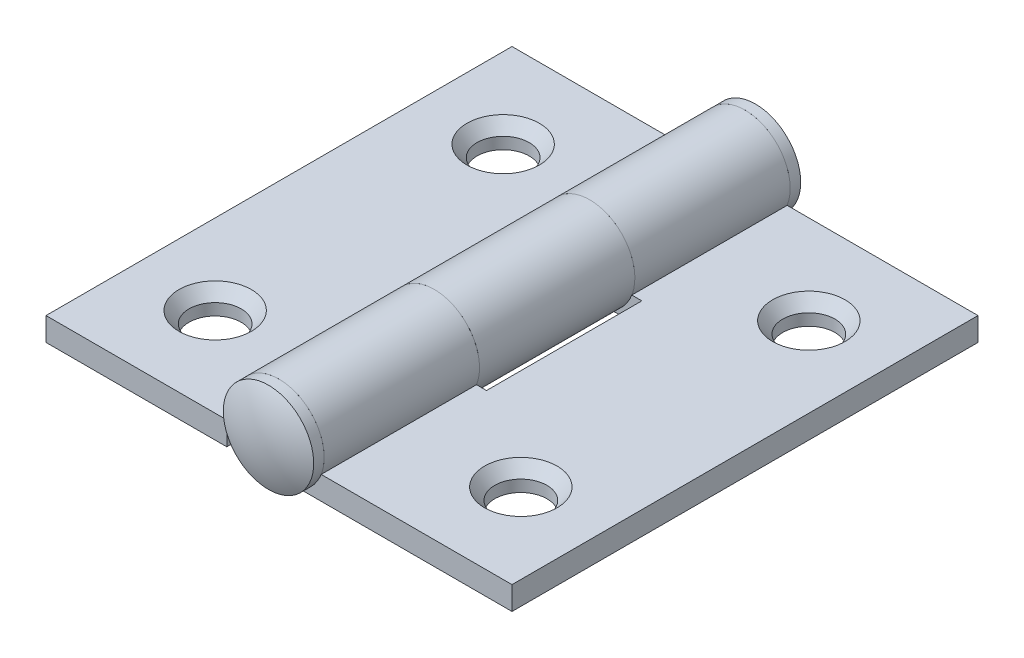
from build123d import *
from OCP.BRepFilletAPI import BRepFilletAPI_MakeChamfer

# Parameters (mm, degrees)
SKETCH1_R                 = 1.190625
EXTRUDE1_DEPTH            = 12.7
SKETCH1_W                 = 9.8552
SKETCH1_H                 = 1.27
EXTRUDE1_2_DEPTH          = 12.7
SKETCH20_R                = 1.4224
EXTRUDE24_DEPTH           = 20.082626232
CHAMFER2_SIZE             = 0.635
CHAMFER2_SIZE2            = 0.551997079
CHAMFER2_OF_MIRROR2_SIZE  = 0.635
CHAMFER2_OF_MIRROR2_SIZE2 = 0.551997079
EXTRUDE4_DEPTH            = 19.94700397
EXTRUDE4_DEPTH_BACK       = 19.94700397
SKETCH8_W                 = 5.6896
SKETCH8_H                 = 8.466666666
SKETCH9_R                 = 1.190625
EXTRUDE5_DEPTH            = 8.466666667


with BuildPart() as part:
    # Sketch1 → Extrude1 (new, symmetric)
    with BuildSketch(Plane.XY):
        with BuildLine():
            Line((12.7, -2.157017049), (1.190625, -2.157017049))
            ThreePointArc((1.190625, -2.157017049), (-1.856577095, 1.619701185), (2.298588957, -0.887017049))
            Line((2.298588957, -0.887017049), (12.7, -0.887017049))
            Line((12.7, -0.887017049), (12.7, -2.157017049))
        make_face()
        Circle(SKETCH1_R, mode=Mode.SUBTRACT)
    extrude(amount=EXTRUDE1_DEPTH, both=True)


with BuildPart() as body_2:
    # Sketch1 → Extrude1 2 (new, symmetric)
    with BuildSketch(Plane.XY):
        with Locations((-7.7724, -1.522017049)):
            Rectangle(SKETCH1_W, SKETCH1_H)
    extrude(amount=EXTRUDE1_2_DEPTH, both=True)

    # Sketch20 → Extrude24 (cut, through all)
    with BuildSketch(Plane(origin=(0, -0.887017049, 0), x_dir=(1, 0, 0), z_dir=(0, 1, 0))):
        with Locations(Location((-8.3312, 7.8486, 0), (0, 0, 270))):
            Circle(SKETCH20_R)
        with Locations(Location((-8.3312, -7.8486, 0), (0, 0, 270))):
            Circle(SKETCH20_R)
    extrude24 = extrude(amount=-EXTRUDE24_DEPTH, mode=Mode.SUBTRACT)

    # Chamfer2: one chamfer whose edges measure the first distance from different faces: ONE call of the kernel's chamfer builder (chamfer() names one face for all edges)
    chamfer2_edges_1 = [body_2.edges().sort_by_distance(p)[0] for p in [
        (-8.3312, -0.887017049, -9.271),
    ]]
    chamfer2_side_1 = [body_2.faces().sort_by_distance(p)[0] for p in [
        (-8.3312, -1.522017049, -9.271),
    ]]
    chamfer2_edges_2 = [body_2.edges().sort_by_distance(p)[0] for p in [
        (-8.3312, -0.887017049, 6.4262),
    ]]
    chamfer2_side_2 = [body_2.faces().sort_by_distance(p)[0] for p in [
        (-8.3312, -1.522017049, 6.4262),
    ]]
    chamfer2 = BRepFilletAPI_MakeChamfer(body_2.part.solid().wrapped)
    for e in chamfer2_edges_1:
        chamfer2.Add(CHAMFER2_SIZE, CHAMFER2_SIZE2, e.wrapped, chamfer2_side_1[0].wrapped)  # the first distance lies on this face
    for e in chamfer2_edges_2:
        chamfer2.Add(CHAMFER2_SIZE, CHAMFER2_SIZE2, e.wrapped, chamfer2_side_2[0].wrapped)  # the first distance lies on this face
    add(Compound.cast(chamfer2.Shape()), mode=Mode.REPLACE)

    # Sketch9 → Extrude5 (add)
    with BuildSketch(Plane.XY.offset(-4.233333333)):
        with BuildLine():
            Line((-2.298588957, -0.887017049), (-2.8448, -0.887017049))
            Line((-2.8448, -0.887017049), (-2.8448, -2.157017049))
            Line((-2.8448, -2.157017049), (-1.190625, -2.157017049))
            ThreePointArc((-1.190625, -2.157017049), (1.856577095, 1.619701185), (-2.298588957, -0.887017049))
        make_face()
        with Locations(Location((0, 0, 0), (0, 0, 180))):
            Circle(SKETCH9_R, mode=Mode.SUBTRACT)
    extrude(amount=EXTRUDE5_DEPTH)


with BuildPart() as body_3:
    # Sketch6 → Revolve1 (revolve)
    with BuildSketch(Plane(origin=(0, 0, 0), x_dir=(1, 0, 0), z_dir=(0, 1, 0))):
        with BuildLine():
            Line((-2.4638, -12.7), (-2.4638, -13.2715))
            ThreePointArc((-2.4638, -13.2715), (-1.264606924, -13.698253184), (0, -13.843))
            Line((0, -13.843), (0, 13.843))
            ThreePointArc((0, 13.843), (-1.264606924, 13.698253184), (-2.4638, 13.2715))
            Line((-2.4638, 13.2715), (-2.4638, 12.7))
            Line((-2.4638, 12.7), (-1.190625, 12.7))
            Line((-1.190625, 12.7), (-1.190625, -12.7))
            Line((-1.190625, -12.7), (-2.4638, -12.7))
        make_face()
    revolve(axis=Axis((0, 0, -13.843), (0, 0, 1)))


with BuildPart() as part_1:
    add(part.part)

    # Mirror2: Extrude24 across plane
    add(extrude24.mirror(Plane(origin=(0, 0, 0), x_dir=(0, 0, 1), z_dir=(1, 0, 0))), mode=Mode.SUBTRACT)

    # Chamfer2 of Mirror2: one chamfer whose edges measure the first distance from different faces: ONE call of the kernel's chamfer builder (chamfer() names one face for all edges)
    chamfer2_of_mirror2_edges_1 = [part_1.edges().sort_by_distance(p)[0] for p in [
        (8.3312, -0.887017049, -9.271),
    ]]
    chamfer2_of_mirror2_side_1 = [part_1.faces().sort_by_distance(p)[0] for p in [
        (8.3312, -1.522017049, -9.271),
    ]]
    chamfer2_of_mirror2_edges_2 = [part_1.edges().sort_by_distance(p)[0] for p in [
        (8.3312, -0.887017049, 6.4262),
    ]]
    chamfer2_of_mirror2_side_2 = [part_1.faces().sort_by_distance(p)[0] for p in [
        (8.3312, -1.522017049, 6.4262),
    ]]
    chamfer2_of_mirror2 = BRepFilletAPI_MakeChamfer(part_1.part.solid().wrapped)
    for e in chamfer2_of_mirror2_edges_1:
        chamfer2_of_mirror2.Add(CHAMFER2_OF_MIRROR2_SIZE, CHAMFER2_OF_MIRROR2_SIZE2, e.wrapped, chamfer2_of_mirror2_side_1[0].wrapped)  # the first distance lies on this face
    for e in chamfer2_of_mirror2_edges_2:
        chamfer2_of_mirror2.Add(CHAMFER2_OF_MIRROR2_SIZE, CHAMFER2_OF_MIRROR2_SIZE2, e.wrapped, chamfer2_of_mirror2_side_2[0].wrapped)  # the first distance lies on this face
    add(Compound.cast(chamfer2_of_mirror2.Shape()), mode=Mode.REPLACE)

    # Sketch8 → Extrude4 (cut, two sides: drawn at the far end of the back side and taken through both)
    with BuildSketch(Plane(origin=(0, 0, 0), x_dir=(1, 0, 0), z_dir=(0, 1, 0)).offset(-EXTRUDE4_DEPTH_BACK)):
        Rectangle(SKETCH8_W, SKETCH8_H)
    extrude(amount=EXTRUDE4_DEPTH + EXTRUDE4_DEPTH_BACK, mode=Mode.SUBTRACT)


solid = Compound([body_2.part, body_3.part, part_1.part])
